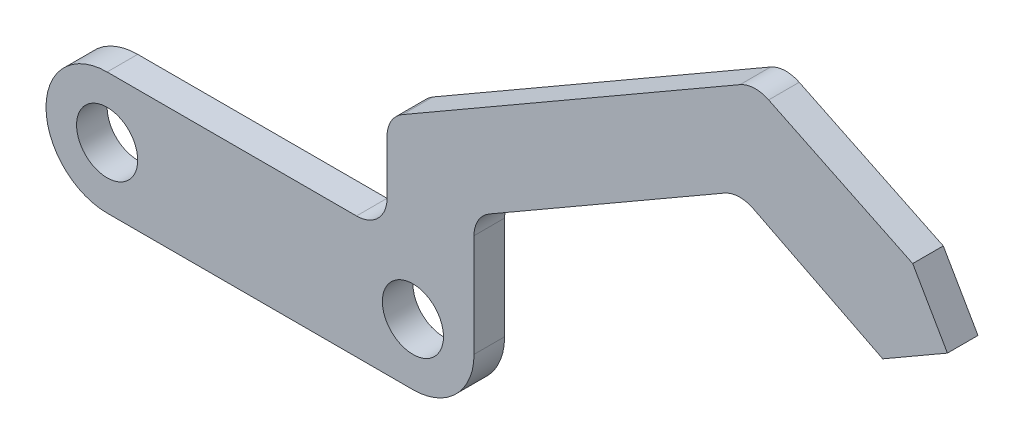
from build123d import *

# Parameters (mm, degrees)
SKETCH1_R           = 3
BOSS_EXTRUDE1_DEPTH = 3
FILLET1_R           = 3
FILLET2_R           = 3
FILLET3_R           = 3


with BuildPart() as part:
    # Sketch1 → Boss-Extrude1 (new body)
    with BuildSketch(Plane.XY):
        with BuildLine():
            Line((27.478538516, 6), (0, 6))
            ThreePointArc((0, 6), (-6, 0), (0, -6))
            Line((0, -6), (30.017, -6))
            ThreePointArc((30.017, -6), (34.259640687, -4.242640687), (36.017, 0))
            Line((36.017, 0), (36.017, 11.821966509))
            Line((36.017, 11.821966509), (62.002996518, 26.812896598))
            Line((62.002996518, 26.812896598), (76.138457922, 19.6799669))
            Line((76.138457922, 19.6799669), (82.48746868, 23.342615602))
            Line((82.48746868, 23.342615602), (79.078019732, 29.252717774))
            Line((79.078019732, 29.252717774), (63.506652751, 36.784076585))
            Line((63.506652751, 36.784076585), (27.478538516, 16))
            Line((27.478538516, 16), (27.478538516, 6))
        make_face()
        Circle(SKETCH1_R, mode=Mode.SUBTRACT)
        with Locations((30.017, 0)):
            Circle(SKETCH1_R, mode=Mode.SUBTRACT)
    extrude(amount=BOSS_EXTRUDE1_DEPTH)

    # Fillet1
    fillet1_edges = [part.edges().sort_by_distance(p)[0] for p in [
        (27.478538516, 16, 1.5),
    ]]
    fillet(fillet1_edges, radius=FILLET1_R)

    # Fillet2
    fillet2_edges = [part.edges().sort_by_distance(p)[0] for p in [
        (27.478538516, 6, 1.5),
    ]]
    fillet(fillet2_edges, radius=FILLET2_R)

    # Fillet3
    fillet3_edges = [part.edges().sort_by_distance(p)[0] for p in [
        (63.506652751, 36.784076585, 1.5),
        (62.002996518, 26.812896598, 1.5),
        (36.017, 11.821966509, 1.5),
    ]]
    fillet(fillet3_edges, radius=FILLET3_R)


solid = part.part
